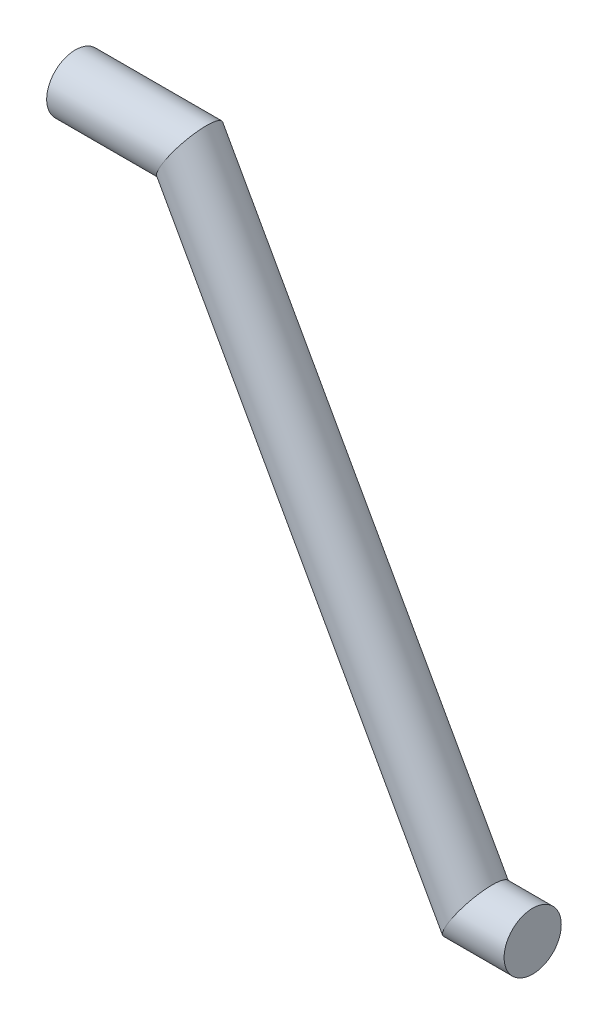
from build123d import *

# Parameters (mm, degrees)
SKETCH1_R = 25


with BuildPart() as part:
    # Sweep1: sweep along a path in Sketch2
    with BuildLine(Plane.XY) as sweep1_path:
        Line((0, 0), (100, 0))
        Line((100, 0), (350, -450))
        Line((350, -450), (400, -450))
    # Sketch1 → Sweep1 (sweep)
    with BuildSketch(Plane(origin=(0, 0, 0), x_dir=(0, 0, -1), z_dir=(1, 0, 0))):
        Circle(SKETCH1_R)
    sweep(path=sweep1_path.line, transition=Transition.RIGHT)


solid = part.part
